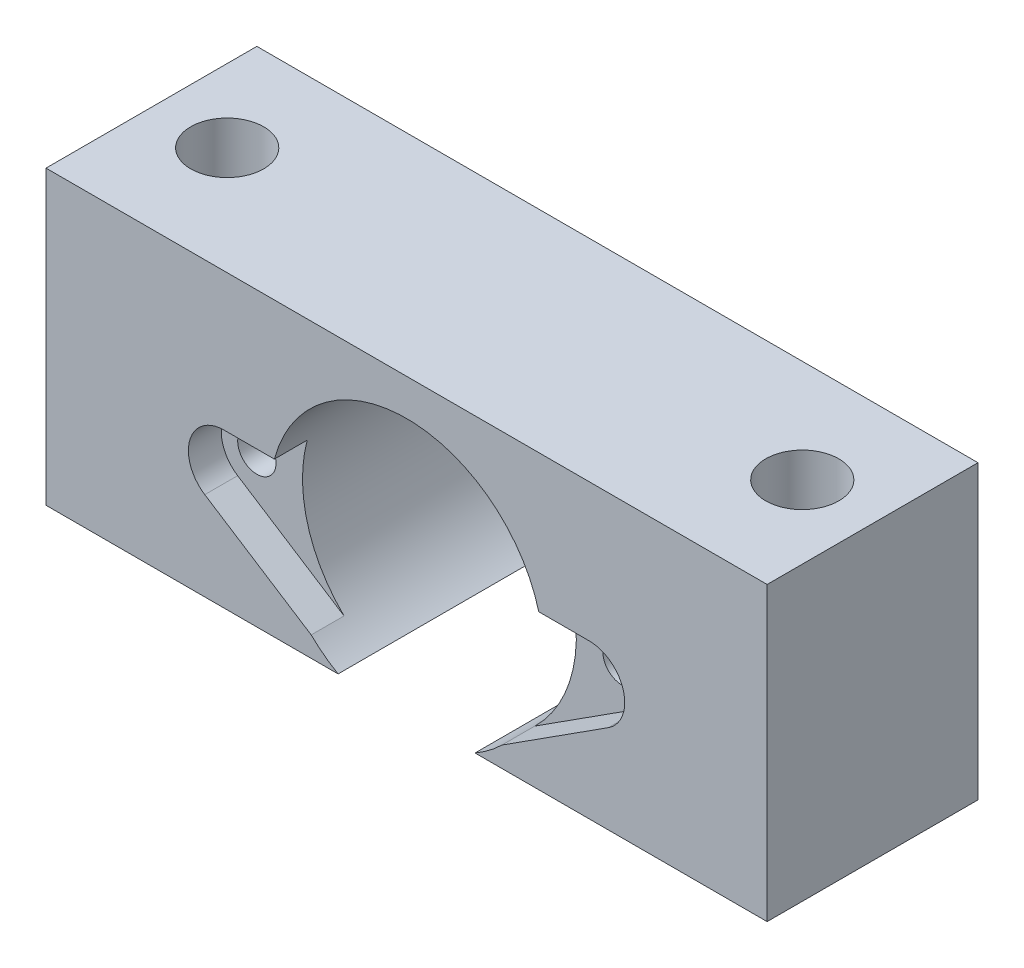
from build123d import *

# Parameters (mm, degrees)
BODY_EXTRUDE_DEPTH                       = 11.55
BODY_4_R                                 = 1.05
WINGS_CUT_EXTRUDE_DEPTH                  = 1.8
BODY_5_R                                 = 1.05
SCREW_HOLES_CUT_EXTRUDE_DEPTH            = 6
ADJUSTMENT_START                         = -15.995191
ADJUSTMENT_SCREW_HOLES_R                 = 2
ADJUSTMENT_SCREW_HOLES_CUT_EXTRUDE_DEPTH = 15.995191


with BuildPart() as part:
    # BODY → Body Extrude (new body)
    with BuildSketch(Plane.XY.offset(-35.57079385)):
        with BuildLine():
            Line((-3.75, -6.495190528), (-19.75, -6.495190528))
            Line((-19.75, -6.495190528), (-19.75, 9.5))
            Line((-19.75, 9.5), (19.75, 9.5))
            Line((19.75, 9.5), (19.75, -6.495190528))
            Line((19.75, -6.495190528), (3.75, -6.495190528))
            ThreePointArc((3.75, -6.495190528), (0, 7.5), (-3.75, -6.495190528))
        make_face()
    extrude(amount=-BODY_EXTRUDE_DEPTH)

    # BODY<4> → Wings Cut Extrude (cut)
    # profile 1 of 4: a face of its own
    with BuildSketch(Plane.XY.offset(-35.57079385)):
        with BuildLine():
            Line((10, 1.95), (7.242064623, 1.95))
            ThreePointArc((7.242064623, 1.95), (7.231272158, -1.98964896), (5.225169177, -5.380298047))
            Line((5.225169177, -5.380298047), (11.053, -1.641246782))
            ThreePointArc((11.053, -1.641246782), (11.711118056, -0.935187147), (11.95, 0))
            ThreePointArc((11.95, 0), (11.378858223, 1.378858223), (10, 1.95))
        make_face()
        with BuildLine():
            ThreePointArc((8.8, 0), (10, 1.2), (11.2, 0))
            ThreePointArc((11.2, 0), (10, -1.2), (8.8, 0))
        make_face(mode=Mode.SUBTRACT)
    # profile 2 of 4: a face of its own
    with BuildSketch(Plane.XY.offset(-35.57079385)):
        with BuildLine():
            ThreePointArc((11.2, 0), (10, -1.2), (8.8, 0))
            ThreePointArc((8.8, 0), (10, 1.2), (11.2, 0))
        make_face()
        with Locations((10, 0)):
            Circle(BODY_4_R, mode=Mode.SUBTRACT)
    # profile 3 of 4: a face of its own
    with BuildSketch(Plane.XY.offset(-35.57079385)):
        with BuildLine():
            Line((-11.053, -1.641246782), (-5.225169177, -5.380298047))
            ThreePointArc((-5.225169177, -5.380298047), (-7.231272158, -1.98964896), (-7.242064623, 1.95))
            Line((-7.242064623, 1.95), (-10, 1.95))
            ThreePointArc((-10, 1.95), (-11.871220354, 0.548666007), (-11.053, -1.641246782))
        make_face()
        with BuildLine():
            ThreePointArc((-11.2, 0), (-10, 1.2), (-8.8, 0))
            ThreePointArc((-8.8, 0), (-10, -1.2), (-11.2, 0))
        make_face(mode=Mode.SUBTRACT)
    # profile 4 of 4: a face of its own
    with BuildSketch(Plane.XY.offset(-35.57079385)):
        with BuildLine():
            ThreePointArc((-8.8, 0), (-10, -1.2), (-11.2, 0))
            ThreePointArc((-11.2, 0), (-10, 1.2), (-8.8, 0))
        make_face()
        with Locations((-10, 0)):
            Circle(BODY_4_R, mode=Mode.SUBTRACT)
    extrude(amount=-WINGS_CUT_EXTRUDE_DEPTH, mode=Mode.SUBTRACT)

    # BODY<5> → Screw Holes Cut Extrude (cut)
    with BuildSketch(Plane.XY.offset(-35.57079385)):
        with Locations((-10, 0)):
            Circle(BODY_5_R)
        with Locations((10, 0)):
            Circle(BODY_5_R)
    extrude(amount=-SCREW_HOLES_CUT_EXTRUDE_DEPTH, mode=Mode.SUBTRACT)

    # ADJUSTMENT SCREW HOLES → Adjustment Screw Holes Cut Extrude (cut)
    with BuildSketch(Plane(origin=(0, 9.5, 0), x_dir=(1, 0, 0), z_dir=(0, 1, 0)).offset(ADJUSTMENT_START)):
        with Locations(Location((-15.75, 41.49579385, 0), (0, 0, 270))):
            Circle(ADJUSTMENT_SCREW_HOLES_R)
        with Locations(Location((15.75, 41.49579385, 0), (0, 0, 270))):
            Circle(ADJUSTMENT_SCREW_HOLES_R)
    extrude(amount=ADJUSTMENT_SCREW_HOLES_CUT_EXTRUDE_DEPTH, mode=Mode.SUBTRACT)


solid = part.part
